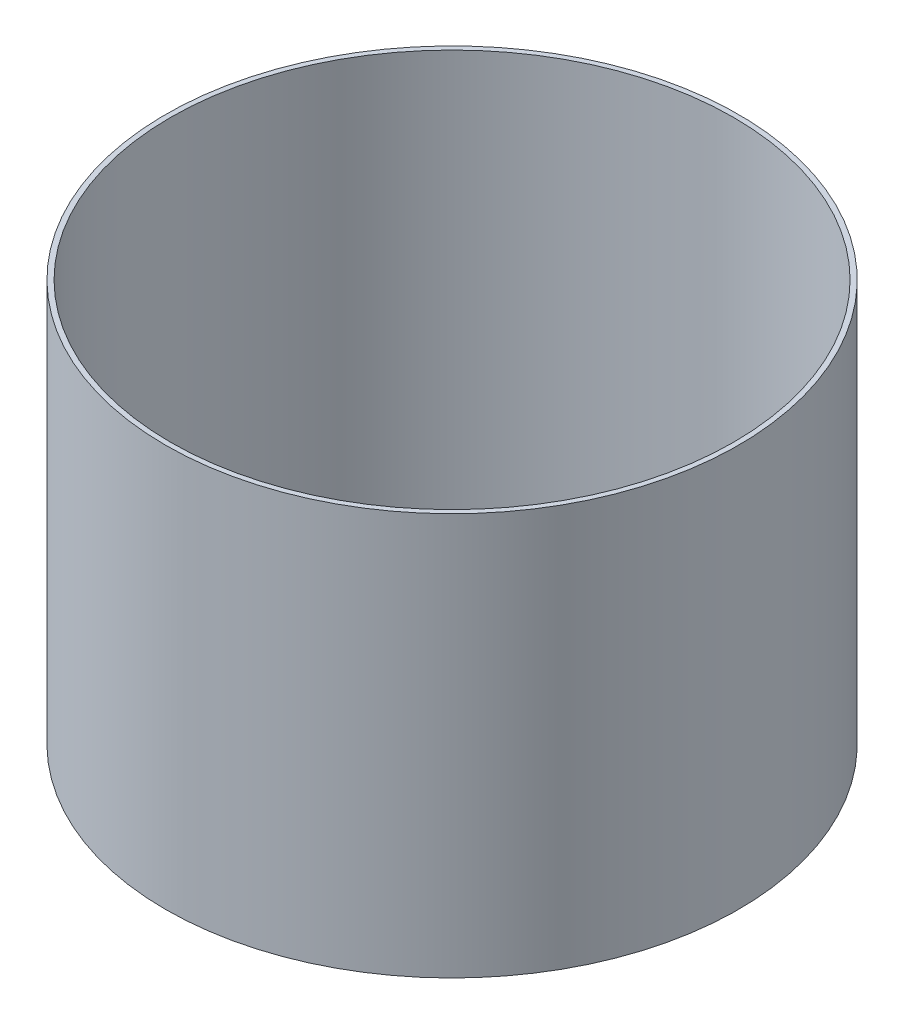
from build123d import *

# Parameters (mm, degrees)
SKETCH1_R           = 28.5
SKETCH1_R_2         = 28
BOSS_EXTRUDE1_DEPTH = 40


with BuildPart() as part:
    # Sketch1 → Boss-Extrude1 (new body)
    with BuildSketch(Plane(origin=(0, 0, 0), x_dir=(1, 0, 0), z_dir=(0, 1, 0))):
        with Locations(Location((0, 0, 0), (0, 0, 270))):
            Circle(SKETCH1_R)
        with Locations(Location((0, 0, 0), (0, 0, 270))):
            Circle(SKETCH1_R_2, mode=Mode.SUBTRACT)
    extrude(amount=BOSS_EXTRUDE1_DEPTH)


solid = part.part
